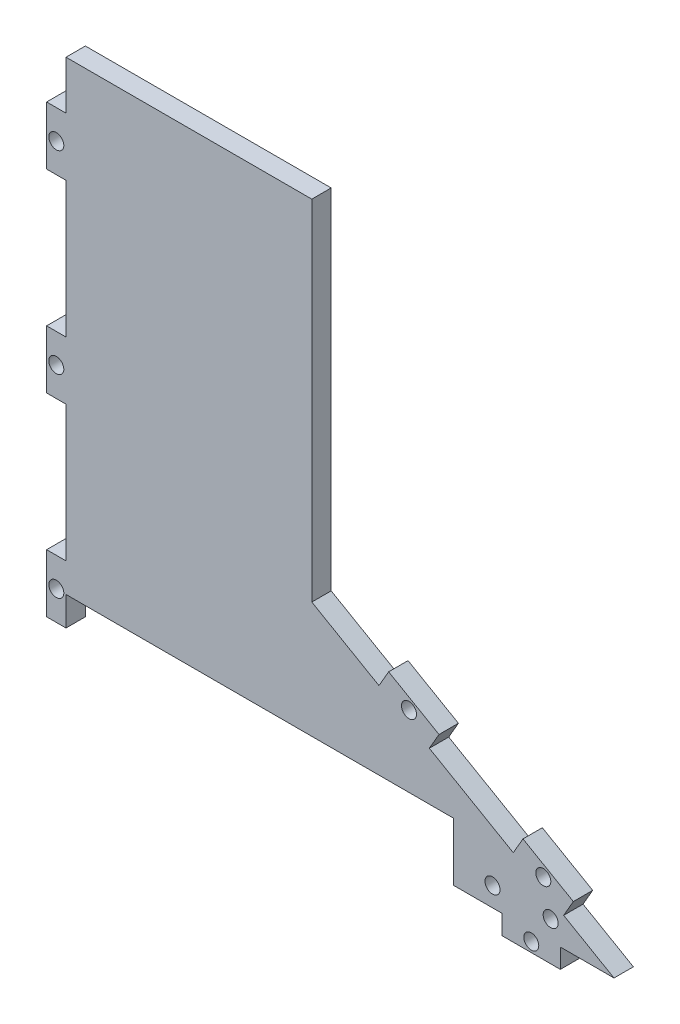
from build123d import *

# Parameters (mm, degrees)
BOSS_EXTRUDE1_DEPTH          = 6.35
SKETCH2_W                    = 127
SKETCH2_H                    = 19.05
CUT_EXTRUDE1_DEPTH           = 195.543611155
SKETCH3_W                    = 86.864773719
SKETCH3_H                    = 114.3
BOSS_EXTRUDE2_DEPTH          = 6.35
SKETCH4_W                    = 6.35
SKETCH4_H                    = 9.525
SKETCH4_H_2                  = 44.45
SKETCH4_H_3                  = 15.875
CUT_EXTRUDE2_DEPTH           = 253.93516292
SKETCH5_W                    = 19.05
SKETCH5_H                    = 6.35
BOSS_EXTRUDE3_DEPTH          = 6.35
BOSS_EXTRUDE4_DEPTH          = 6.35
LPATTERN1_COUNT              = 2
LPATTERN1_PITCH              = 50.8
F_10_0_1935_DIAMETER_HOLE1_D = 4.9149
F_10_0_1935_DIAMETER_HOLE2_D = 4.9149
F_10_0_1935_DIAMETER_HOLE3_D = 4.9149


with BuildPart() as part:
    # Sketch1 → Boss-Extrude1 (new body)
    with BuildSketch(Plane.XY):
        Polygon((86.864773719, 57.15), (185.851477372, 0), (86.864773719, 0), (0, 0), (0, 57.15), align=None)
    extrude(amount=BOSS_EXTRUDE1_DEPTH)

    # Sketch2 → Cut-Extrude1 (cut, through all)
    with BuildSketch(Plane.XY.offset(6.35)):
        with Locations((69.85, 9.525)):
            Rectangle(SKETCH2_W, SKETCH2_H)
    extrude(amount=-CUT_EXTRUDE1_DEPTH, mode=Mode.SUBTRACT)

    # Sketch3 → Boss-Extrude2 (add)
    with BuildSketch(Plane.XY.offset(6.35)):
        with Locations((43.432386859, 114.3)):
            Rectangle(SKETCH3_W, SKETCH3_H)
    extrude(amount=-BOSS_EXTRUDE2_DEPTH)

    # Sketch4 → Cut-Extrude2 (cut, through all)
    with BuildSketch(Plane.XY.offset(6.35)):
        with Locations((3.175, 4.7625)):
            Rectangle(SKETCH4_W, SKETCH4_H)
        with Locations((3.175, 50.8)):
            Rectangle(SKETCH4_W, SKETCH4_H_2)
        with Locations((3.175, 114.3)):
            Rectangle(SKETCH4_W, SKETCH4_H_2)
        with Locations((3.175, 163.5125)):
            Rectangle(SKETCH4_W, SKETCH4_H_3)
    extrude(amount=-CUT_EXTRUDE2_DEPTH, mode=Mode.SUBTRACT)

    # Sketch5 → Boss-Extrude3 (add)
    with BuildSketch(Plane.XY.offset(6.35)):
        with Locations((158.75, -3.175)):
            Rectangle(SKETCH5_W, SKETCH5_H)
    extrude(amount=-BOSS_EXTRUDE3_DEPTH)

    # Sketch6 → Boss-Extrude4 (add)
    with BuildSketch(Plane.XY.offset(6.35)):
        Polygon((108.861818976, 44.45), (125.359602918, 34.925), (128.534602918, 40.424261314), (112.036818976, 49.949261314), align=None)
    boss_extrude4 = extrude(amount=-BOSS_EXTRUDE4_DEPTH)

    # LPattern1: Boss-Extrude4 ×2
    with Locations(*[Vector(0.8660254037844415, -0.49999999999999517, 0) * (i * LPATTERN1_PITCH) for i in range(1, LPATTERN1_COUNT)]):
        add(boss_extrude4)

    # #10 (0.1935) Diameter Hole1 (through all)
    with Locations(Plane.XY.offset(6.35)):
        with Locations((3.175, 146.05), (3.175, 82.55), (3.175, 19.05)):
            Hole(F_10_0_1935_DIAMETER_HOLE1_D / 2)

    # #10 (0.1935) Diameter Hole2 (through all)
    with Locations(Plane.XY.offset(6.35)):
        with Locations((118.698210947, 42.437130657), (162.692301459, 17.037130657), (158.75, -3.175)):
            Hole(F_10_0_1935_DIAMETER_HOLE2_D / 2)

    # #10 (0.1935) Diameter Hole3 (through all)
    with Locations(Plane.XY.offset(6.35)):
        with Locations((146.05, 6.35), (165.1, 6.35)):
            Hole(F_10_0_1935_DIAMETER_HOLE3_D / 2)


solid = part.part
